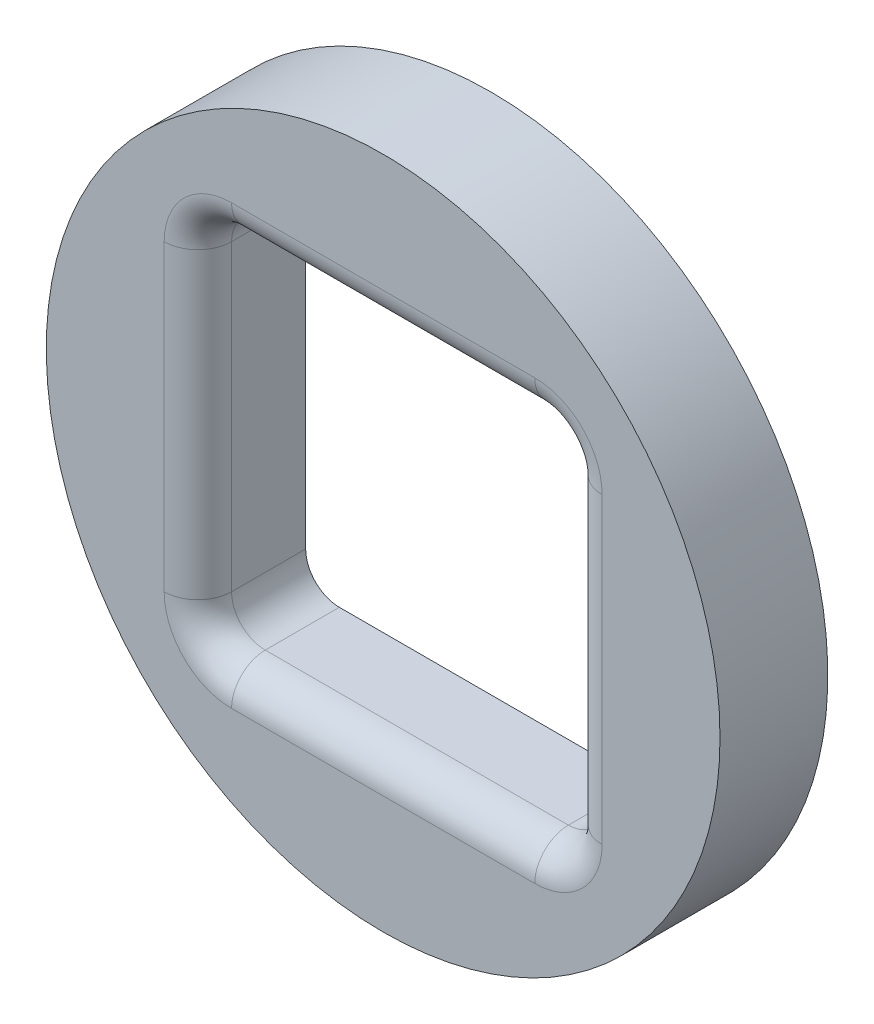
from build123d import *

# Parameters (mm, degrees)
SKETCH1_R               = 25
SKETCH1_W               = 27.5
SKETCH1_H               = 27.5
BOSS_EXTRUDE1_DEPTH     = 55
BOSS_EXTRUDE2_START     = 5
SKETCH2_R               = 25
BOSS_EXTRUDE2_DEPTH     = 5
SKETCH3_W               = 25
SKETCH3_H               = 50
BOSS_EXTRUDE3_DEPTH     = 80
FILLET1_R               = 2.5
FILLET2_R               = 2.5
SKETCH21_W              = 54.3
SKETCH21_H              = 20.3
CUT_EXTRUDE1_DEPTH      = 11.3
SKETCH22_W              = 40.3
SKETCH22_H              = 20.3
CUT_EXTRUDE2_DEPTH      = 93.059763198
CUT_EXTRUDE3_DEPTH      = 88.464278423
SKETCH23_R              = 2.15
CUT_EXTRUDE4_DEPTH      = 93.059763198
CUT_EXTRUDE7_DEPTH      = 27.5
CUT_EXTRUDE8_DEPTH      = 93.059763198
CUT_EXTRUDE8_DEPTH_BACK = 93.059763198
SKETCH25_W              = 132
SKETCH25_H              = 50


with BuildPart() as part:
    # Sketch1 → Boss-Extrude1 (new body)
    with BuildSketch(Plane.XY):
        Circle(SKETCH1_R)
        Rectangle(SKETCH1_W, SKETCH1_H, mode=Mode.SUBTRACT)
    extrude(amount=BOSS_EXTRUDE1_DEPTH)

    # Sketch2 → Boss-Extrude2 (add)
    with BuildSketch(Plane(origin=(0, 0, 0), x_dir=(-1, 0, 0), z_dir=(0, 0, -1)).offset(BOSS_EXTRUDE2_START)):
        Circle(SKETCH2_R)
    extrude(amount=-BOSS_EXTRUDE2_DEPTH)

    # Sketch3 → Boss-Extrude3 (add)
    with BuildSketch(Plane(origin=(0, 0, -5), x_dir=(-1, 0, 0), z_dir=(0, 0, -1))):
        with Locations((12.5, 0)):
            Rectangle(SKETCH3_W, SKETCH3_H)
    extrude(amount=BOSS_EXTRUDE3_DEPTH)

    # Fillet1
    fillet1_edges = [part.edges().sort_by_distance(p)[0] for p in [
        (-13.75, 13.75, 27.5),
        (13.75, 13.75, 27.5),
        (-13.75, -13.75, 27.5),
        (13.75, -13.75, 27.5),
    ]]
    fillet(fillet1_edges, radius=FILLET1_R)

    # Fillet2
    fillet2_edges = [part.edges().sort_by_distance(p)[0] for p in [
        (13.75, 0, 55),
    ]]
    fillet(fillet2_edges, radius=FILLET2_R)

    # Sketch21 → Cut-Extrude1 (cut)
    with BuildSketch(Plane(origin=(0, 0, 0), x_dir=(0, 0, -1), z_dir=(1, 0, 0))):
        with Locations((51.85, 0)):
            Rectangle(SKETCH21_W, SKETCH21_H)
    extrude(amount=-CUT_EXTRUDE1_DEPTH, mode=Mode.SUBTRACT)

    # Sketch22 → Cut-Extrude2 (cut, through all)
    with BuildSketch(Plane(origin=(0, 0, 0), x_dir=(0, 0, -1), z_dir=(1, 0, 0))):
        with Locations((51.7, 0)):
            Rectangle(SKETCH22_W, SKETCH22_H)
    extrude(amount=-CUT_EXTRUDE2_DEPTH, mode=Mode.SUBTRACT)

    # Sketch18 → Cut-Extrude3 (cut, through all)
    with BuildSketch(Plane.XY.offset(-5)):
        with BuildLine():
            Line((-25, -25), (0, -25))
            ThreePointArc((0, -25), (-17.67766953, -17.67766953), (-25, 0))
            Line((-25, 0), (-25, -25))
        make_face()
        with BuildLine():
            Line((-25, 25), (-25, 0))
            ThreePointArc((-25, 0), (-17.67766953, 17.67766953), (0, 25))
            Line((0, 25), (-25, 25))
        make_face()
    extrude(amount=-CUT_EXTRUDE3_DEPTH, mode=Mode.SUBTRACT)

    # Sketch23 → Cut-Extrude4 (cut, through all)
    with BuildSketch(Plane(origin=(0, 0, 0), x_dir=(0, 0, -1), z_dir=(1, 0, 0))):
        with Locations((75.85, 5.25)):
            Circle(SKETCH23_R)
        with Locations((75.85, -5.25)):
            Circle(SKETCH23_R)
        with Locations((27.85, 5.25)):
            Circle(SKETCH23_R)
        with Locations((27.85, -5.25)):
            Circle(SKETCH23_R)
    extrude(amount=-CUT_EXTRUDE4_DEPTH, mode=Mode.SUBTRACT)

    # Sketch24 → Cut-Extrude7 (cut, symmetric)
    with BuildSketch(Plane(origin=(0, 0, -51.7), x_dir=(-1, 0, 0), z_dir=(0, 0, -1))):
        with BuildLine():
            Line((13.3, 10.15), (13.3, -10.15))
            Line((13.3, -10.15), (22.846826913, -10.15))
            ThreePointArc((22.846826913, -10.15), (25, 0), (22.846826913, 10.15))
            Line((22.846826913, 10.15), (13.3, 10.15))
        make_face()
    extrude(amount=CUT_EXTRUDE7_DEPTH, both=True, mode=Mode.SUBTRACT)

    # Sketch25 → Cut-Extrude8 (cut, two sides: drawn at the far end of the back side and taken through both)
    with BuildSketch(Plane(origin=(0, 0, 0), x_dir=(0, 0, -1), z_dir=(1, 0, 0)).offset(-CUT_EXTRUDE8_DEPTH_BACK)):
        with Locations((19, 0)):
            Rectangle(SKETCH25_W, SKETCH25_H)
    extrude(amount=CUT_EXTRUDE8_DEPTH + CUT_EXTRUDE8_DEPTH_BACK, mode=Mode.SUBTRACT)


solid = part.part
